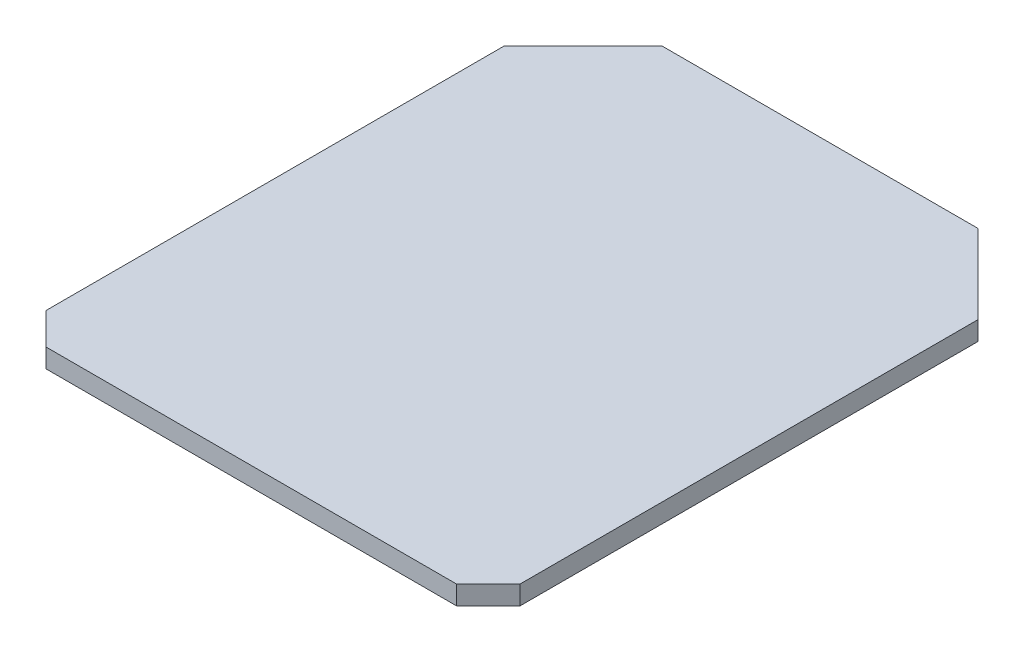
from build123d import *

# Parameters (mm, degrees)
BOSS_EXTRUDE1_DEPTH = 6


with BuildPart() as part:
    # Sketch5 → Boss-Extrude1 (new body)
    with BuildSketch(Plane(origin=(0, 0, 0), x_dir=(1, 0, 0), z_dir=(0, 1, 0))):
        Polygon((0, 155), (25, 180), (125, 180), (150, 155), (150, 10), (140, 0), (10, 0), (0, 10), align=None)
    extrude(amount=BOSS_EXTRUDE1_DEPTH)


solid = part.part
